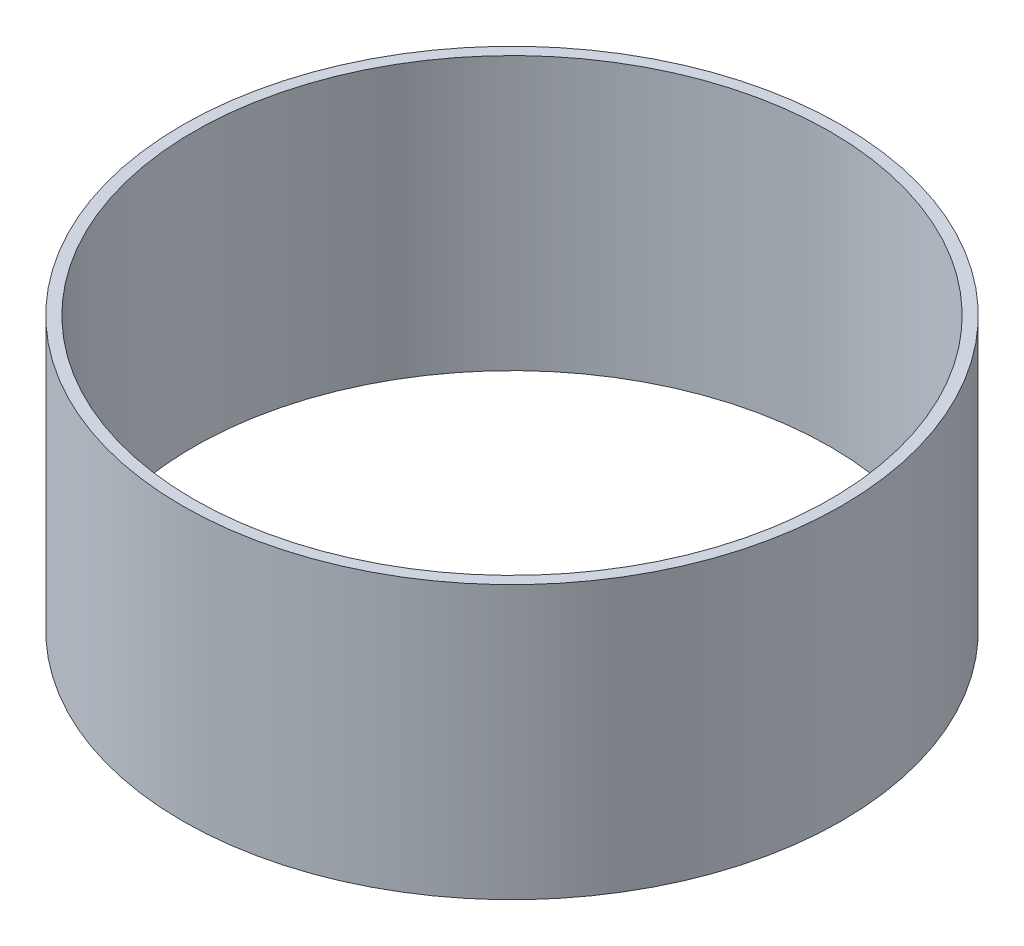
from build123d import *

# Parameters (mm, degrees)
SKETCH1_R           = 92.075
SKETCH1_R_2         = 88.9
BOSS_EXTRUDE1_DEPTH = 38.1


with BuildPart() as part:
    # Sketch1 → Boss-Extrude1 (new, symmetric)
    with BuildSketch(Plane(origin=(0, 0, 0), x_dir=(1, 0, 0), z_dir=(0, 1, 0))):
        with Locations(Location((0, 0, 0), (0, 0, 90))):
            Circle(SKETCH1_R)
        with Locations(Location((0, 0, 0), (0, 0, 90))):
            Circle(SKETCH1_R_2, mode=Mode.SUBTRACT)
    extrude(amount=BOSS_EXTRUDE1_DEPTH, both=True)


solid = part.part
